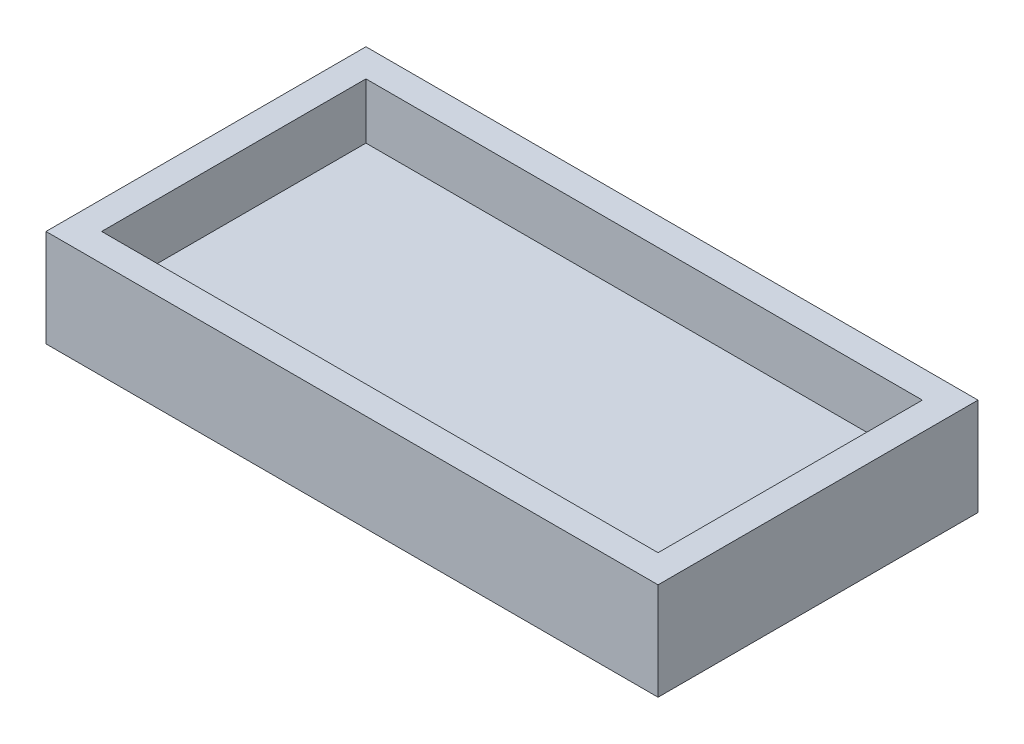
from build123d import *

# Parameters (mm, degrees)
SKETCH1_W           = 40
SKETCH1_H           = 19
BOSS_EXTRUDE1_DEPTH = 3
SKETCH2_W           = 44
SKETCH2_H           = 23
SKETCH2_W_2         = 40
SKETCH2_H_2         = 19
BOSS_EXTRUDE2_DEPTH = 7


with BuildPart() as part:
    # Sketch1 → Boss-Extrude1 (new body)
    with BuildSketch(Plane(origin=(0, 0, 0), x_dir=(1, 0, 0), z_dir=(0, 1, 0))):
        Rectangle(SKETCH1_W, SKETCH1_H)
    extrude(amount=BOSS_EXTRUDE1_DEPTH)

    # Sketch2 → Boss-Extrude2 (add)
    with BuildSketch(Plane.XZ):
        Rectangle(SKETCH2_W, SKETCH2_H)
        Rectangle(SKETCH2_W_2, SKETCH2_H_2, mode=Mode.SUBTRACT)
    extrude(amount=-BOSS_EXTRUDE2_DEPTH)


solid = part.part
